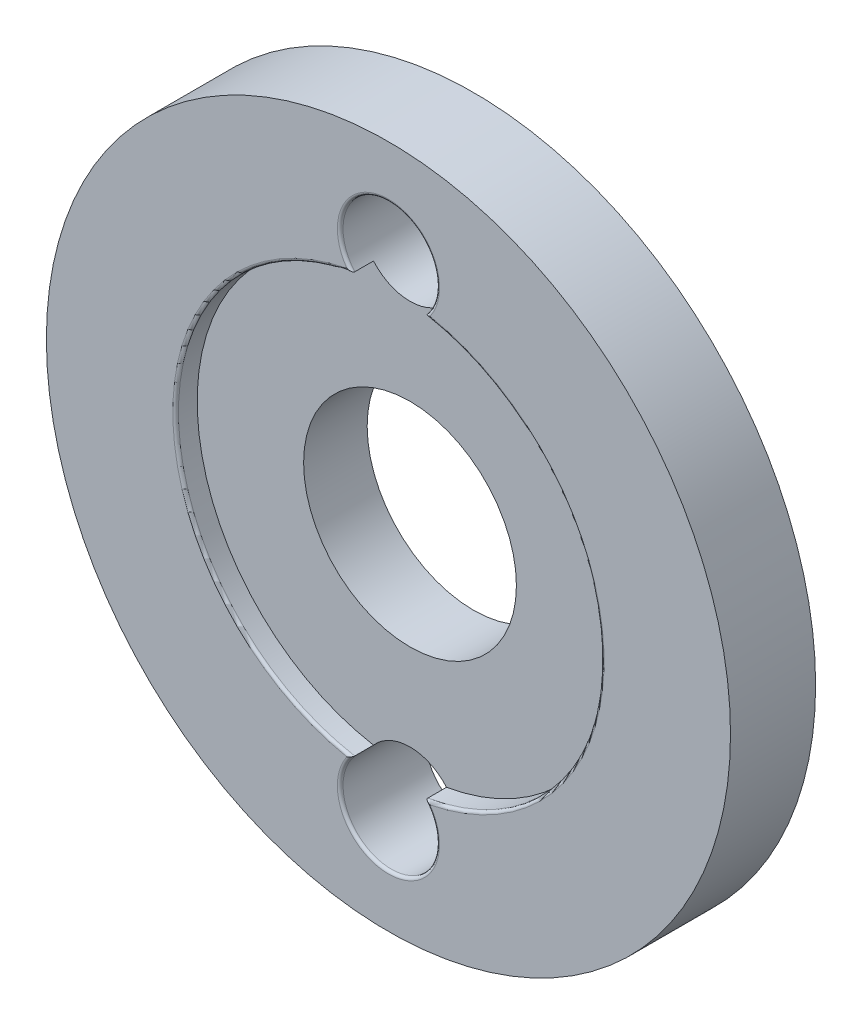
from build123d import *

# Parameters (mm, degrees)
ESBO_O2_R                = 3.75
RESSALTO_EXTRUS_O6_DEPTH = 2.24
ESBO_O2_6_R              = 12.055555556
RESSALTO_EXTRUS_O7_DEPTH = 3
FILETE3_R                = 0.1


with BuildPart() as part:
    # Esboço2 → Ressalto-extrusão6 (new body)
    with BuildSketch(Plane.XY):
        with BuildLine():
            ThreePointArc((-1.286579516, 7.388823529), (-6.144565705, 4.3005014), (-7.382691193, -1.321314024))
            ThreePointArc((-7.382691193, -1.321314024), (-5.290815774, -5.31575662), (-1.286579516, -7.388823529))
            ThreePointArc((-1.286579516, -7.388823529), (0, -6.8), (1.286579516, -7.388823529))
            ThreePointArc((1.286579516, -7.388823529), (6.144565705, -4.3005014), (7.382691193, 1.321314024))
            ThreePointArc((7.382691193, 1.321314024), (5.290815774, 5.31575662), (1.286579516, 7.388823529))
            ThreePointArc((1.286579516, 7.388823529), (0, 6.8), (-1.286579516, 7.388823529))
        make_face()
        Circle(ESBO_O2_R, mode=Mode.SUBTRACT)
    extrude(amount=RESSALTO_EXTRUS_O6_DEPTH)

    # Esboço2<6> → Ressalto-extrusão7 (add)
    with BuildSketch(Plane.XY):
        Circle(ESBO_O2_6_R)
        with BuildLine():
            ThreePointArc((-1.286579516, -7.388823529), (-5.290815774, -5.31575662), (-7.382691193, -1.321314024))
            ThreePointArc((-7.382691193, -1.321314024), (-6.144565705, 4.3005014), (-1.286579516, 7.388823529))
            ThreePointArc((-1.286579516, 7.388823529), (-0.592796265, 10.09329614), (1.7, 8.5))
            ThreePointArc((1.7, 8.5), (1.59329614, 7.907203735), (1.286579516, 7.388823529))
            ThreePointArc((1.286579516, 7.388823529), (5.290815774, 5.31575662), (7.382691193, 1.321314024))
            ThreePointArc((7.382691193, 1.321314024), (6.144565705, -4.3005014), (1.286579516, -7.388823529))
            ThreePointArc((1.286579516, -7.388823529), (1.59329614, -7.907203735), (1.7, -8.5))
            ThreePointArc((1.7, -8.5), (-0.592796265, -10.09329614), (-1.286579516, -7.388823529))
        make_face(mode=Mode.SUBTRACT)
    extrude(amount=RESSALTO_EXTRUS_O7_DEPTH)

    # Filete3
    filete3_edges = [part.edges().sort_by_distance(p)[0] for p in [
        (0, -10.2, 3),
        (7.5, 0, 3),
        (-7.5, 0, 3),
        (-0.592796265, 10.09329614, 3),
    ]]
    fillet(filete3_edges, radius=FILETE3_R)


solid = part.part
